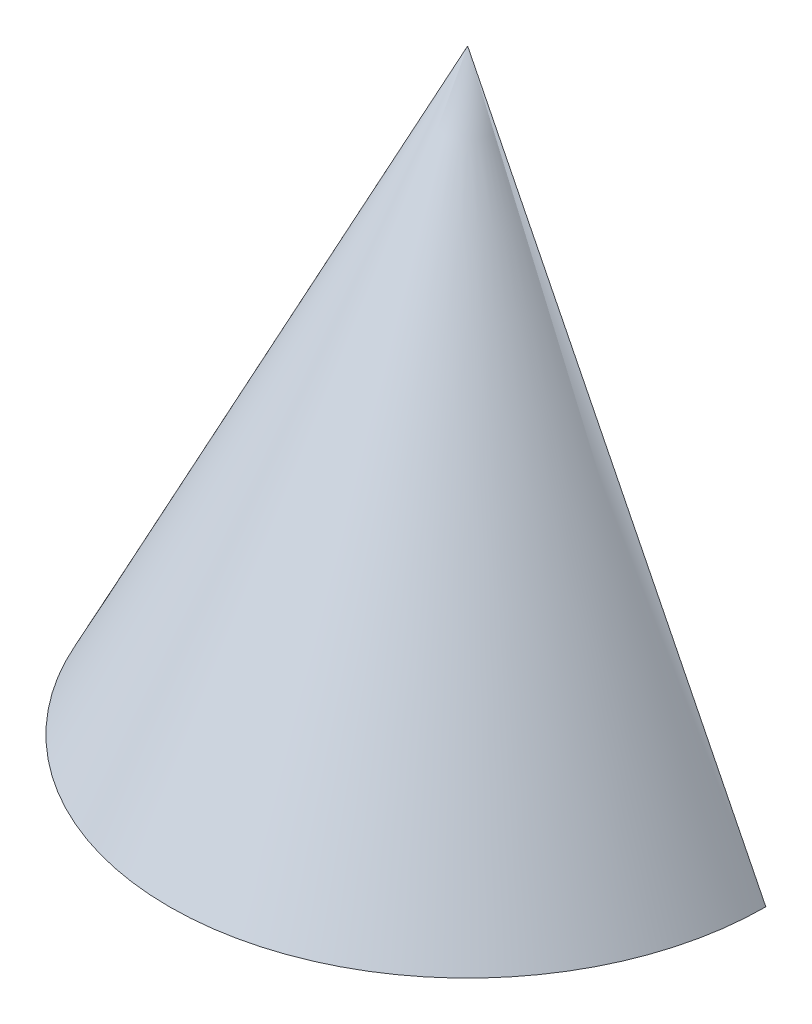
from build123d import *

# Parameters (mm, degrees)
REVOLVE1_ANGLE      = 180
BOSS_EXTRUDE1_DEPTH = 2.5
BOSS_EXTRUDE2_DEPTH = 2.5
BOSS_EXTRUDE3_DEPTH = 2.5


with BuildPart() as part:
    # Sketch1 → Revolve1 (revolve)
    with BuildSketch(Plane.XY):
        Polygon((0, 0), (45, 0), (0, 90), align=None)
    revolve(axis=Axis((0, 90, 0), (0, -1, 0)), revolution_arc=REVOLVE1_ANGLE)

    # Sketch2 → Cut-Revolve1 (revolve, cut)
    with BuildSketch(Plane(origin=(0, 0, 0), x_dir=(-1, 0, 0), z_dir=(0, 0, -1))):
        Polygon((0, 0), (0, 85), (-42.509177555, 0), align=None)
    revolve(axis=Axis((0, 0, 0), (0, 1, 0)), mode=Mode.SUBTRACT)

    # Sketch3 → Boss-Extrude1 (add)
    with BuildSketch(Plane(origin=(0, 0, 0), x_dir=(-1, 0, 0), z_dir=(0, -1, 0))):
        with BuildLine():
            Line((42.509177555, 0), (-42.509177555, 0))
            ThreePointArc((-42.509177555, 0), (0, -42.509177555), (42.509177555, 0))
        make_face()
    extrude(amount=-BOSS_EXTRUDE1_DEPTH)

    # Sketch4 → Boss-Extrude2 (add)
    with BuildSketch(Plane(origin=(0, 10, 0), x_dir=(-1, 0, 0), z_dir=(0, -1, 0))):
        with BuildLine():
            Line((-38.221336586, 0), (38.221336586, 0))
            ThreePointArc((38.221336586, 0), (0, -38.221336586), (-38.221336586, 0))
        make_face()
    extrude(amount=-BOSS_EXTRUDE2_DEPTH)

    # Sketch5 → Boss-Extrude3 (add)
    with BuildSketch(Plane(origin=(0, 20, 0), x_dir=(-1, 0, 0), z_dir=(0, -1, 0))):
        with BuildLine():
            Line((-33.5, 0), (33.5, 0))
            ThreePointArc((33.5, 0), (0, -33.5), (-33.5, 0))
        make_face()
    extrude(amount=-BOSS_EXTRUDE3_DEPTH)


solid = part.part
